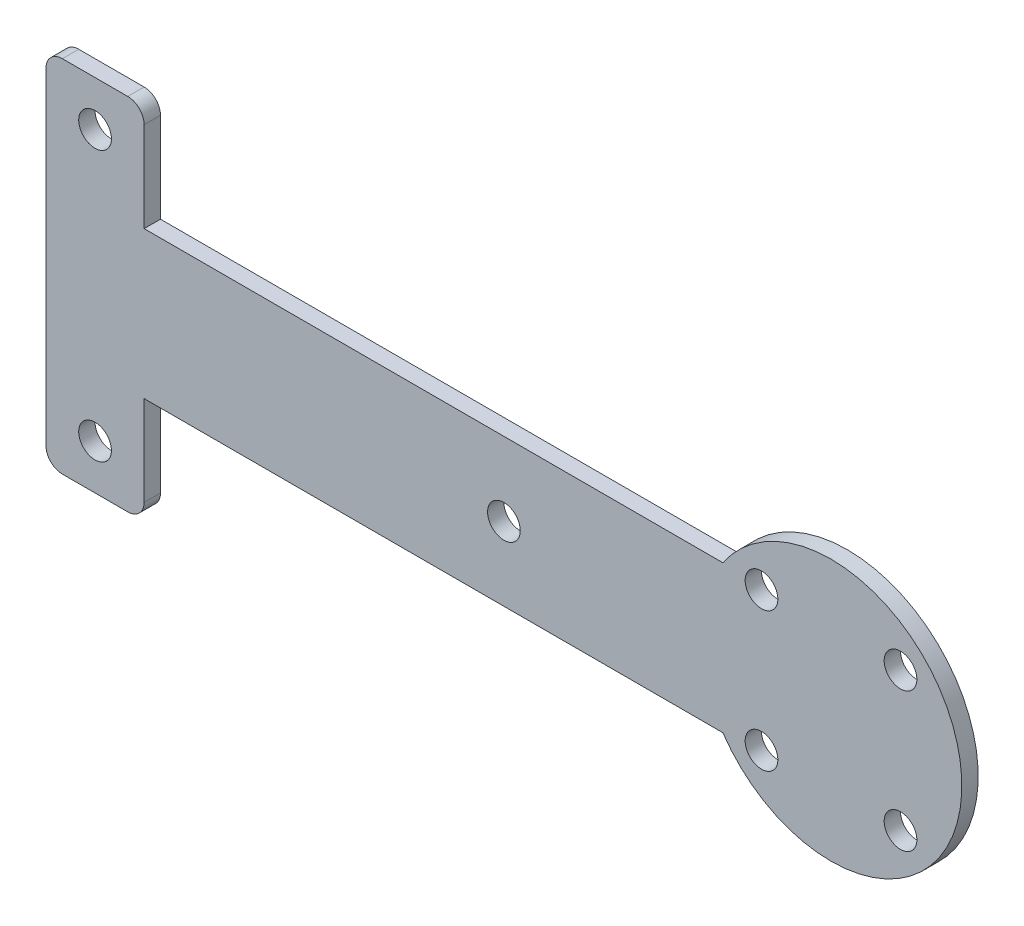
from build123d import *

# Parameters (mm, degrees)
SKETCH_1_R      = 2
EXTRUDE_1_DEPTH = 2
FILLET_1_R      = 2


with BuildPart() as part:
    # 草图1 → 凸台-拉伸1 (new body)
    with BuildSketch(Plane.XY):
        with BuildLine():
            Line((-42.723571429, 9.145714286), (-42.723571429, 22.145714286))
            Line((-42.723571429, 22.145714286), (-54.723571429, 22.145714286))
            Line((-54.723571429, 22.145714286), (-54.723571429, -21.854285714))
            Line((-54.723571429, -21.854285714), (-42.723571429, -21.854285714))
            Line((-42.723571429, -21.854285714), (-42.723571429, -8.854285714))
            Line((-42.723571429, -8.854285714), (28.047672016, -8.854285714))
            ThreePointArc((28.047672016, -8.854285714), (57.276428571, 0.145714286), (28.047672016, 9.145714286))
            Line((28.047672016, 9.145714286), (-42.723571429, 9.145714286))
        make_face()
        with Locations((1.276428571, 0.145714286)):
            Circle(SKETCH_1_R, mode=Mode.SUBTRACT)
        with Locations((-48.723571429, 16.645714286)):
            Circle(SKETCH_1_R, mode=Mode.SUBTRACT)
        with Locations((-48.723571429, -16.354285714)):
            Circle(SKETCH_1_R, mode=Mode.SUBTRACT)
        with Locations((49.776428571, -8.354285714)):
            Circle(SKETCH_1_R, mode=Mode.SUBTRACT)
        with Locations((32.776428571, -8.354285714)):
            Circle(SKETCH_1_R, mode=Mode.SUBTRACT)
        with Locations((32.776428571, 8.645714286)):
            Circle(SKETCH_1_R, mode=Mode.SUBTRACT)
        with Locations((49.776428571, 8.645714286)):
            Circle(SKETCH_1_R, mode=Mode.SUBTRACT)
    extrude(amount=EXTRUDE_1_DEPTH)

    # 圆角1
    fillet_1_edges = [part.edges().sort_by_distance(p)[0] for p in [
        (-42.723571429, -21.854285714, 1),
        (-54.723571429, -21.854285714, 1),
        (-54.723571429, 22.145714286, 1),
        (-42.723571429, 22.145714286, 1),
    ]]
    fillet(fillet_1_edges, radius=FILLET_1_R)


solid = part.part
